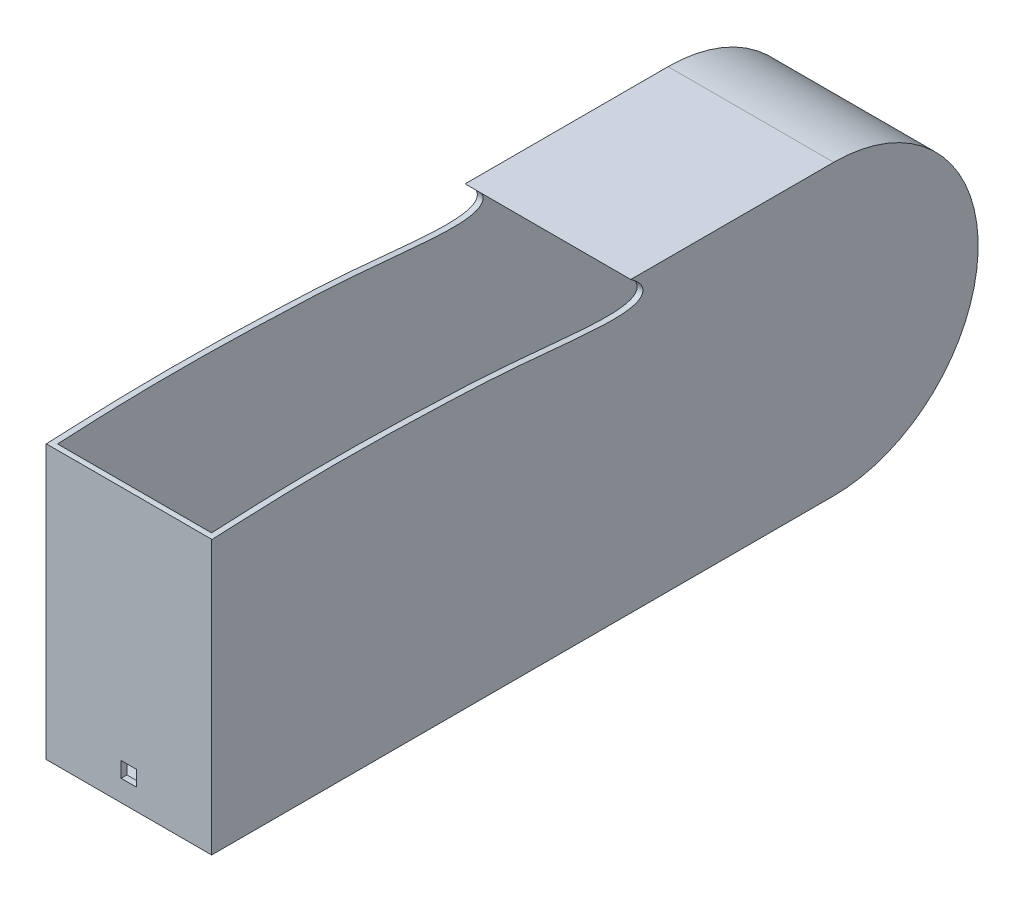
from build123d import *

# Parameters (mm, degrees)
BOSS_EXTRUDE1_DEPTH            = 63.5
BOSS_EXTRUDE1_DEPTH_BACK       = 63.5
CUT_EXTRUDE1_REACH             = 678.53
SKETCH4_W                      = 12.7
SKETCH4_H                      = 12.7
BOSS_EXTRUDE3_DEPTH            = 4.7625
CUT_EXTRUDE2_REACH             = 569.489
CUT_EXTRUDE2_DIRECTION_2_REACH = 569.489
CUT_EXTRUDE3_DEPTH             = 136.525


with BuildPart() as part:
    # Sketch2 → Boss-Extrude1 (new, two sides: drawn at the far end of the back side and taken through both)
    with BuildSketch(Plane(origin=(0, 0, 0), x_dir=(0, 0, -1), z_dir=(1, 0, 0)).offset(-BOSS_EXTRUDE1_DEPTH_BACK)):
        with BuildLine():
            Line((0, -4.7625), (-512.7625, -4.7625))
            Line((-512.7625, -4.7625), (-512.7625, 233.3625))
            Line((-512.7625, 233.3625), (0, 233.3625))
            ThreePointArc((0, 233.3625), (119.0625, 114.3), (0, -4.7625))
        make_face()
        with BuildLine():
            Line((0, 0), (-508, 0))
            Line((-508, 0), (-508, 228.6))
            Line((-508, 228.6), (0, 228.6))
            ThreePointArc((0, 228.6), (114.3, 114.3), (0, 0))
        make_face(mode=Mode.SUBTRACT)
    extrude(amount=BOSS_EXTRUDE1_DEPTH + BOSS_EXTRUDE1_DEPTH_BACK)

    # Sketch4 → Cut-Extrude1 (cut, up to next)
    with BuildSketch(Plane.XY.offset(512.7625), mode=Mode.PRIVATE) as cut_extrude1_sk1:
        with Locations((0, 19.05)):
            Rectangle(SKETCH4_W, SKETCH4_H)
    cut_extrude1_tool1 = extrude(cut_extrude1_sk1.sketch, amount=-CUT_EXTRUDE1_REACH, mode=Mode.PRIVATE) & part.part
    add(cut_extrude1_tool1.solids().sort_by_distance((0, 19.05, 512.7625))[0], mode=Mode.SUBTRACT)

    # Sketch9 → Boss-Extrude3 (add)
    with BuildSketch(Plane(origin=(63.5, 0, 0), x_dir=(0, 0, -1), z_dir=(1, 0, 0))):
        with BuildLine():
            Line((-512.7625, 233.3625), (0, 233.3625))
            ThreePointArc((0, 233.3625), (119.0625, 114.3), (0, -4.7625))
            Line((0, -4.7625), (-512.7625, -4.7625))
            Line((-512.7625, -4.7625), (-512.7625, 233.3625))
        make_face()
    boss_extrude3 = extrude(amount=BOSS_EXTRUDE3_DEPTH)

    # Mirror1: Boss-Extrude3 across plane
    add(boss_extrude3.mirror(Plane(origin=(0, 0, 0), x_dir=(0, 0, 1), z_dir=(1, 0, 0))))

    # Sketch11 → Cut-Extrude2 (cut, up to next)
    with BuildSketch(Plane(origin=(0, 0, 0), x_dir=(0, 0, -1), z_dir=(1, 0, 0)), mode=Mode.PRIVATE) as cut_extrude2_sk1:
        with BuildLine():
            Line((-512.7625, 220.6625), (-512.849393223, 221.103452286))
            add(Edge.make_bspline(
                [(-512.849393223, 221.103452286), (-512.532700595, 221.211009466), (-511.270901441, 221.63954978), (-508.44642109, 222.600485882), (-503.762953517, 224.150302439), (-497.269998464, 226.259749178), (-489.023245355, 228.841368447), (-479.10000481, 231.813872481), (-467.597978696, 235.083165457), (-454.628032508, 238.545255758), (-440.321148985, 242.094575026), (-424.821429797, 245.617549826), (-408.294927933, 249.024771645), (-390.914504443, 252.20432036), (-372.867862768, 255.061254061), (-354.353343741, 257.520201331), (-335.579209389, 259.500514547), (-316.747059388, 260.937616248), (-297.94181928, 261.853164618), (-279.366079575, 261.889242872), (-261.280070346, 260.902418125), (-244.058757053, 258.98503391), (-227.929585221, 256.246806811), (-213.104456806, 252.805079969), (-199.768656161, 248.825528286), (-188.077495343, 244.484590441), (-178.156217252, 239.956374948), (-170.098201624, 235.414103694), (-163.938608789, 231.017198213), (-159.710140529, 226.860803831), (-157.282866367, 222.931348779), (-157.078551081, 218.986296857), (-159.430374502, 215.836723639), (-163.53769494, 213.876038864), (-169.178489437, 212.601675942), (-176.441431937, 211.952589942), (-185.254497433, 211.854882503), (-195.533579013, 212.250908039), (-207.163351661, 213.05360896), (-220.024740235, 214.17353372), (-233.993166749, 215.488554617), (-248.94317648, 216.89092489), (-264.745709996, 218.26416395), (-281.270044114, 219.486485379), (-298.511284992, 220.428545699), (-316.315771527, 221.118607839), (-334.495805294, 221.829251021), (-352.735682057, 222.413221363), (-370.831925379, 222.857510837), (-388.591608724, 223.140033413), (-405.819175726, 223.252027693), (-422.322545069, 223.203320199), (-437.915565221, 223.020606612), (-452.418364345, 222.71075189), (-465.660747498, 222.338100855), (-477.491371257, 221.908988988), (-487.744754133, 221.495841487), (-496.366215664, 221.0476688), (-503.053640958, 220.841691742), (-508.205599593, 220.266487962), (-510.755855294, 220.648579963), (-512.722990842, 219.934638372), (-512.753149809, 220.490245125), (-512.7625, 220.6625)],
                knots=[0, 0, 0, 0, 0.001371577, 0.005464776, 0.012234802, 0.021601969, 0.033461345, 0.04767125, 0.064081318, 0.082496261, 0.102719149, 0.124527079, 0.147675648, 0.171912573, 0.19697838, 0.222596912, 0.248496767, 0.274385101, 0.300041178, 0.325689988, 0.350525088, 0.374279703, 0.396711254, 0.417576734, 0.436654006, 0.45374439, 0.468679994, 0.481329415, 0.491630702, 0.499615789, 0.505546281, 0.510184984, 0.514824194, 0.520701508, 0.52851604, 0.538465752, 0.550542609, 0.564643256, 0.580638139, 0.598344876, 0.617584458, 0.638174401, 0.65992209, 0.682632113, 0.706120665, 0.730727383, 0.755700244, 0.780731769, 0.805564463, 0.829932396, 0.853570292, 0.876213105, 0.897609987, 0.917519394, 0.935698347, 0.951942678, 0.966047159, 0.97783994, 0.987174002, 0.993931501, 0.998018399, 0.999385644, 1, 1, 1, 1], degree=3))
        make_face()
    cut_extrude2_tool1 = extrude(cut_extrude2_sk1.sketch, amount=-CUT_EXTRUDE2_REACH, mode=Mode.PRIVATE) & part.part
    add(cut_extrude2_tool1.solids().sort_by_distance((0, 236.327035, 306.434804))[0], mode=Mode.SUBTRACT)

    # Sketch11 → Cut-Extrude2 direction 2 (cut, up to next)
    with BuildSketch(Plane(origin=(0, 0, 0), x_dir=(0, 0, -1), z_dir=(1, 0, 0)), mode=Mode.PRIVATE) as cut_extrude2_direction_2_sk1:
        with BuildLine():
            Line((-512.7625, 220.6625), (-512.849393223, 221.103452286))
            add(Edge.make_bspline(
                [(-512.849393223, 221.103452286), (-512.532700595, 221.211009466), (-511.270901441, 221.63954978), (-508.44642109, 222.600485882), (-503.762953517, 224.150302439), (-497.269998464, 226.259749178), (-489.023245355, 228.841368447), (-479.10000481, 231.813872481), (-467.597978696, 235.083165457), (-454.628032508, 238.545255758), (-440.321148985, 242.094575026), (-424.821429797, 245.617549826), (-408.294927933, 249.024771645), (-390.914504443, 252.20432036), (-372.867862768, 255.061254061), (-354.353343741, 257.520201331), (-335.579209389, 259.500514547), (-316.747059388, 260.937616248), (-297.94181928, 261.853164618), (-279.366079575, 261.889242872), (-261.280070346, 260.902418125), (-244.058757053, 258.98503391), (-227.929585221, 256.246806811), (-213.104456806, 252.805079969), (-199.768656161, 248.825528286), (-188.077495343, 244.484590441), (-178.156217252, 239.956374948), (-170.098201624, 235.414103694), (-163.938608789, 231.017198213), (-159.710140529, 226.860803831), (-157.282866367, 222.931348779), (-157.078551081, 218.986296857), (-159.430374502, 215.836723639), (-163.53769494, 213.876038864), (-169.178489437, 212.601675942), (-176.441431937, 211.952589942), (-185.254497433, 211.854882503), (-195.533579013, 212.250908039), (-207.163351661, 213.05360896), (-220.024740235, 214.17353372), (-233.993166749, 215.488554617), (-248.94317648, 216.89092489), (-264.745709996, 218.26416395), (-281.270044114, 219.486485379), (-298.511284992, 220.428545699), (-316.315771527, 221.118607839), (-334.495805294, 221.829251021), (-352.735682057, 222.413221363), (-370.831925379, 222.857510837), (-388.591608724, 223.140033413), (-405.819175726, 223.252027693), (-422.322545069, 223.203320199), (-437.915565221, 223.020606612), (-452.418364345, 222.71075189), (-465.660747498, 222.338100855), (-477.491371257, 221.908988988), (-487.744754133, 221.495841487), (-496.366215664, 221.0476688), (-503.053640958, 220.841691742), (-508.205599593, 220.266487962), (-510.755855294, 220.648579963), (-512.722990842, 219.934638372), (-512.753149809, 220.490245125), (-512.7625, 220.6625)],
                knots=[0, 0, 0, 0, 0.001371577, 0.005464776, 0.012234802, 0.021601969, 0.033461345, 0.04767125, 0.064081318, 0.082496261, 0.102719149, 0.124527079, 0.147675648, 0.171912573, 0.19697838, 0.222596912, 0.248496767, 0.274385101, 0.300041178, 0.325689988, 0.350525088, 0.374279703, 0.396711254, 0.417576734, 0.436654006, 0.45374439, 0.468679994, 0.481329415, 0.491630702, 0.499615789, 0.505546281, 0.510184984, 0.514824194, 0.520701508, 0.52851604, 0.538465752, 0.550542609, 0.564643256, 0.580638139, 0.598344876, 0.617584458, 0.638174401, 0.65992209, 0.682632113, 0.706120665, 0.730727383, 0.755700244, 0.780731769, 0.805564463, 0.829932396, 0.853570292, 0.876213105, 0.897609987, 0.917519394, 0.935698347, 0.951942678, 0.966047159, 0.97783994, 0.987174002, 0.993931501, 0.998018399, 0.999385644, 1, 1, 1, 1], degree=3))
        make_face()
    cut_extrude2_direction_2_tool1 = extrude(cut_extrude2_direction_2_sk1.sketch, amount=CUT_EXTRUDE2_DIRECTION_2_REACH, mode=Mode.PRIVATE) & part.part
    add(cut_extrude2_direction_2_tool1.solids().sort_by_distance((0, 236.327035, 306.434804))[0], mode=Mode.SUBTRACT)


with BuildPart() as cut_extrude2_piece_1:
    # of the separate pieces the step leaves, piece 1, a body of its own (cut_extrude2_pieces)
    add(part.part.solids().sort_by_distance((68.2625, 233.3625, 0))[0])


with BuildPart() as cut_extrude2_piece_2:
    # of the separate pieces the step leaves, piece 2, a body of its own (cut_extrude2_pieces)
    add(part.part.solids().sort_by_distance((68.2625, 233.3625, 473.623803316))[0])

    # Sketch12 → Cut-Extrude3 (cut)
    with BuildSketch(Plane.ZY.offset(68.2625)):
        with BuildLine():
            Line((512.7625, 221.132963555), (512.7625, 233.3625))
            Line((512.7625, 233.3625), (473.623803288, 233.362500008))
            add(Edge.make_bspline(
                [(473.623803288, 233.362500008), (475.620647135, 232.795545243), (480.944911042, 231.261231316), (489.023245355, 228.841368447), (497.269998464, 226.259749178), (503.762953517, 224.150302439), (508.44642109, 222.600485882), (511.241942115, 221.649402234), (512.474771889, 221.230683977), (512.7625, 221.132963555)],
                knots=[0.000125443, 0.000125443, 0.000125443, 0.000125443, 0.008637848, 0.022847753, 0.034707128, 0.044074296, 0.050844322, 0.054937521, 0.056183654, 0.056183654, 0.056183654, 0.056183654], degree=3))
        make_face()
    extrude(amount=-CUT_EXTRUDE3_DEPTH, mode=Mode.SUBTRACT)


solid = cut_extrude2_piece_1.part
